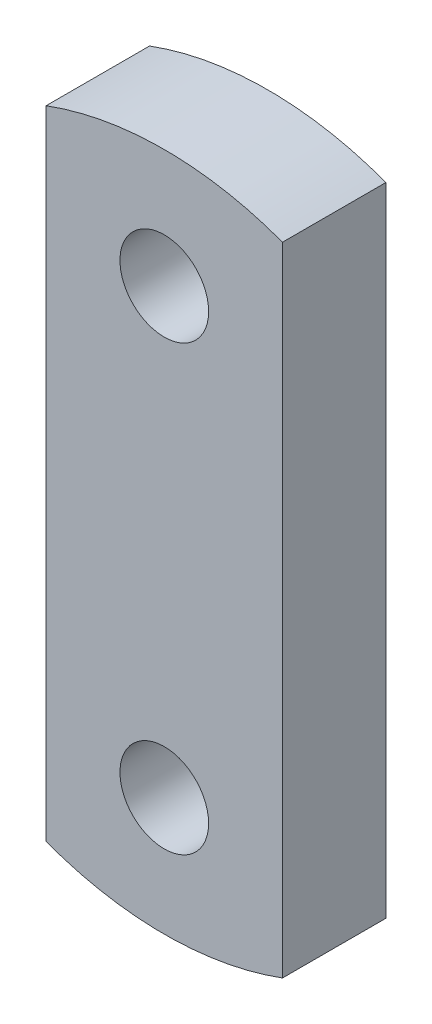
from build123d import *

# Parameters (mm, degrees)
SKETCH1_R           = 15
BOSS_EXTRUDE2_DEPTH = 35


with BuildPart() as part:
    # Sketch1 → Boss-Extrude2 (new body)
    with BuildSketch(Plane.XY):
        with BuildLine():
            Line((-40, 107.819293264), (-40, -107.819293264))
            ThreePointArc((-40, -107.819293264), (0, -115), (40, -107.819293264))
            Line((40, -107.819293264), (40, 107.819293264))
            ThreePointArc((40, 107.819293264), (0, 115), (-40, 107.819293264))
        make_face()
        with Locations((0, 75)):
            Circle(SKETCH1_R, mode=Mode.SUBTRACT)
        with Locations((0, -75)):
            Circle(SKETCH1_R, mode=Mode.SUBTRACT)
    extrude(amount=BOSS_EXTRUDE2_DEPTH)


solid = part.part
